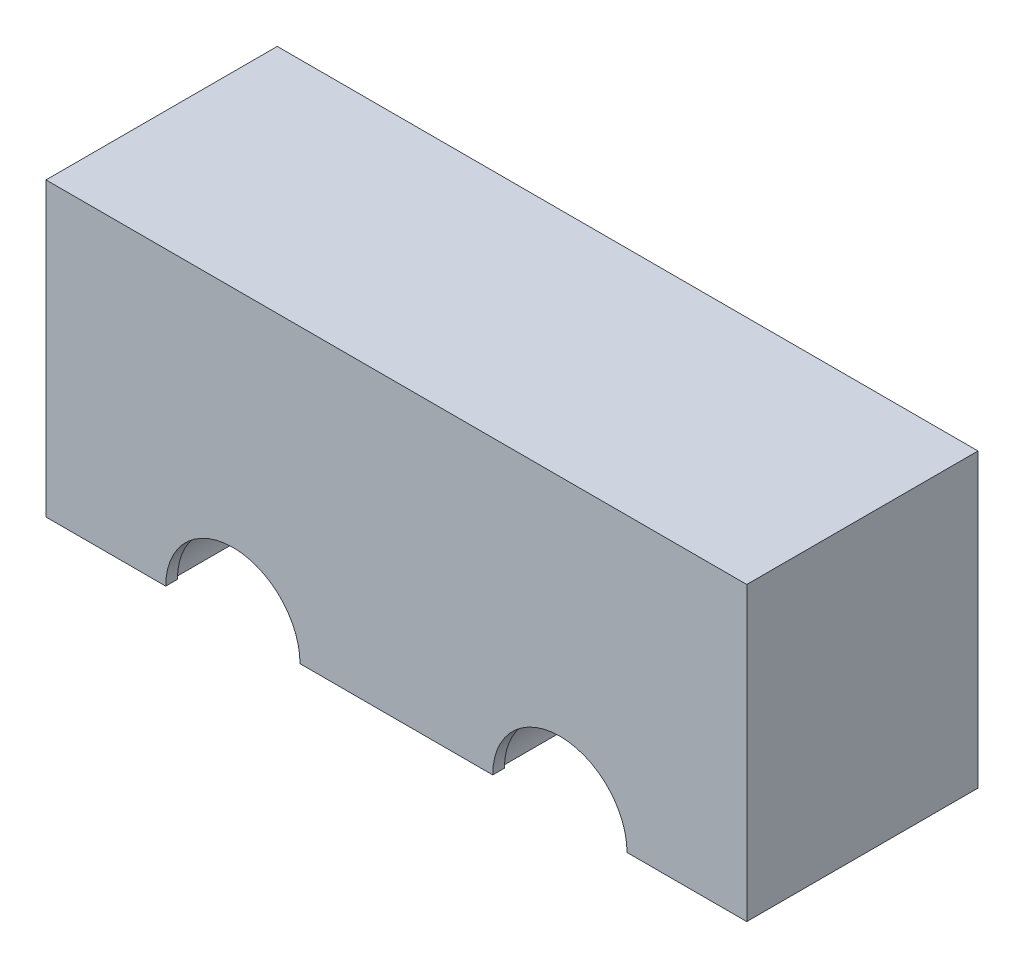
from build123d import *

# Parameters (mm, degrees)
SKETCH1_W           = 60
SKETCH1_H           = 25
BOSS_EXTRUDE1_DEPTH = 19.8
CUT_EXTRUDE3_DEPTH  = 19.8
BOSS_EXTRUDE2_DEPTH = 1
BOSS_EXTRUDE3_START = -18.8
BOSS_EXTRUDE3_DEPTH = 1


with BuildPart() as part:
    # Sketch1 → Boss-Extrude1 (new body)
    with BuildSketch(Plane.XY):
        with Locations((0, 12.5)):
            Rectangle(SKETCH1_W, SKETCH1_H)
    extrude(amount=BOSS_EXTRUDE1_DEPTH)

    # Sketch2 → Cut-Extrude3 (cut)
    with BuildSketch(Plane(origin=(0, 0, 0), x_dir=(-1, 0, 0), z_dir=(0, 0, -1))):
        with BuildLine():
            Line((-20, 0), (-8, 0))
            ThreePointArc((-8, 0), (-14, 6), (-20, 0))
        make_face()
        with BuildLine():
            Line((8, 0), (20, 0))
            ThreePointArc((20, 0), (14, 6), (8, 0))
        make_face()
    extrude(amount=-CUT_EXTRUDE3_DEPTH, mode=Mode.SUBTRACT)

    # Sketch4 → Boss-Extrude2 (add)
    with BuildSketch(Plane(origin=(0, 0, 0), x_dir=(-1, 0, 0), z_dir=(0, 0, -1))):
        with BuildLine():
            Line((-19.75, 0), (-20, 0))
            ThreePointArc((-20, 0), (-14, 6), (-8, 0))
            Line((-8, 0), (-8.25, 0))
            ThreePointArc((-8.25, 0), (-14, 5.75), (-19.75, 0))
        make_face()
        with BuildLine():
            Line((8, 0), (8.25, 0))
            ThreePointArc((8.25, 0), (14, 5.75), (19.75, 0))
            Line((19.75, 0), (20, 0))
            ThreePointArc((20, 0), (14, 6), (8, 0))
        make_face()
    extrude(amount=-BOSS_EXTRUDE2_DEPTH)

    # Sketch4<2> → Boss-Extrude3 (add)
    with BuildSketch(Plane(origin=(0, 0, 0), x_dir=(-1, 0, 0), z_dir=(0, 0, -1)).offset(BOSS_EXTRUDE3_START)):
        with BuildLine():
            Line((-19.75, 0), (-20, 0))
            ThreePointArc((-20, 0), (-14, 6), (-8, 0))
            Line((-8, 0), (-8.25, 0))
            ThreePointArc((-8.25, 0), (-14, 5.75), (-19.75, 0))
        make_face()
        with BuildLine():
            Line((8, 0), (8.25, 0))
            ThreePointArc((8.25, 0), (14, 5.75), (19.75, 0))
            Line((19.75, 0), (20, 0))
            ThreePointArc((20, 0), (14, 6), (8, 0))
        make_face()
    extrude(amount=-BOSS_EXTRUDE3_DEPTH)


solid = part.part
